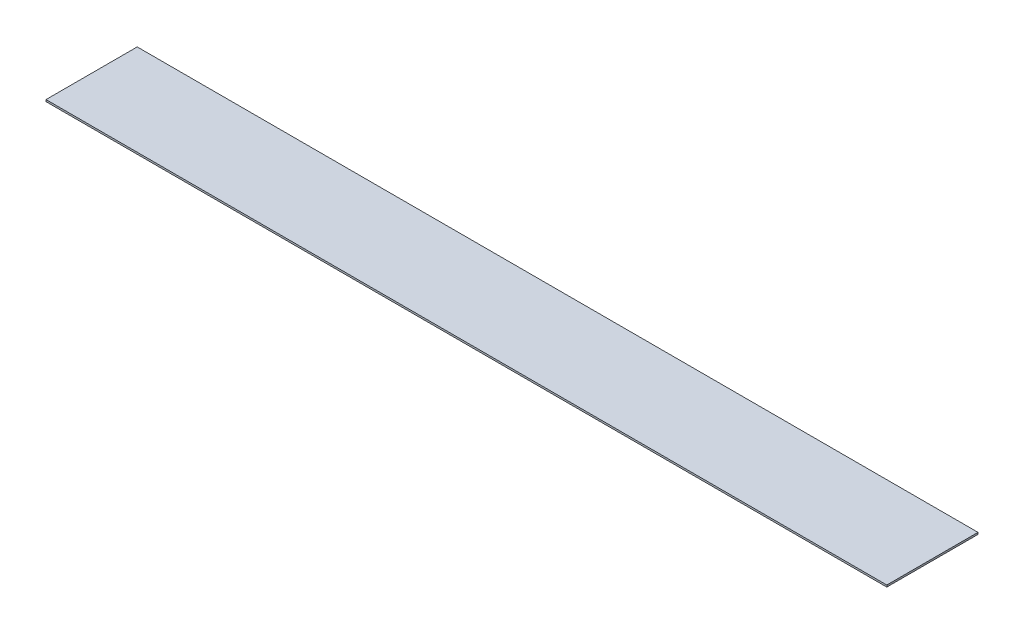
from build123d import *

# Parameters (mm, degrees)
SKETCH_1_W      = 922
SKETCH_1_H      = 100
EXTRUDE_1_DEPTH = 2


with BuildPart() as part:
    # 草图1 → 凸台-拉伸1 (new body)
    with BuildSketch(Plane(origin=(0, 0, 0), x_dir=(1, 0, 0), z_dir=(0, 1, 0))):
        with Locations((0, 50)):
            Rectangle(SKETCH_1_W, SKETCH_1_H)
    extrude(amount=EXTRUDE_1_DEPTH)


solid = part.part
